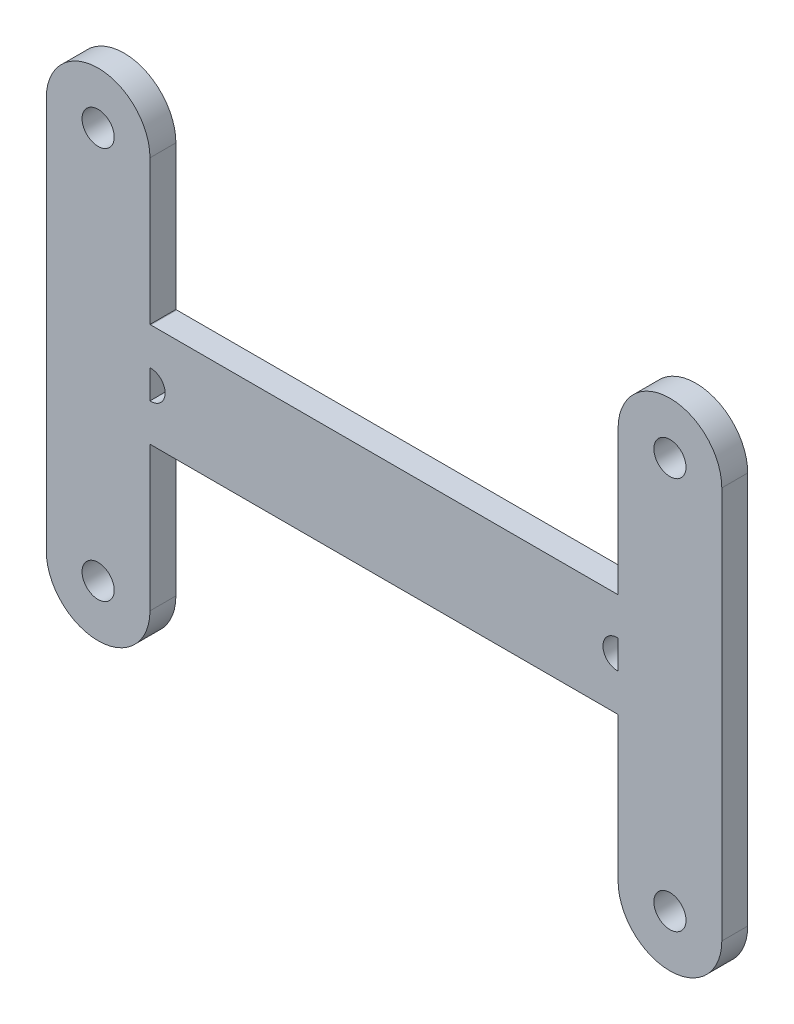
from build123d import *

# Parameters (mm, degrees)
SKETCH_2_R      = 1.55
SKETCH_2_R_2    = 1.384923923
EXTRUDE_1_DEPTH = 2.5


with BuildPart() as part:
    # 草图2 → 凸台-拉伸1 (new body)
    # profile 1 of 3: a face of its own
    with BuildSketch(Plane.XY):
        with BuildLine():
            Line((-22.577164466, 18.92268553), (-22.577164466, -18.92268553))
            ThreePointArc((-22.577164466, -18.92268553), (-27.577164466, -23.92268553), (-32.577164466, -18.92268553))
            Line((-32.577164466, -18.92268553), (-32.577164466, 18.92268553))
            ThreePointArc((-32.577164466, 18.92268553), (-27.577164466, 23.92268553), (-22.577164466, 18.92268553))
        make_face()
        with Locations((-27.577164466, -18.92268553)):
            Circle(SKETCH_2_R, mode=Mode.SUBTRACT)
        with Locations((-27.577164466, 18.92268553)):
            Circle(SKETCH_2_R, mode=Mode.SUBTRACT)
    # profile 2 of 3: a face of its own
    with BuildSketch(Plane.XY):
        with BuildLine():
            Line((22.577164466, 18.92268553), (22.577164466, -18.92268553))
            ThreePointArc((22.577164466, -18.92268553), (27.577164466, -23.92268553), (32.577164466, -18.92268553))
            Line((32.577164466, -18.92268553), (32.577164466, 18.92268553))
            ThreePointArc((32.577164466, 18.92268553), (27.577164466, 23.92268553), (22.577164466, 18.92268553))
        make_face()
        with Locations((27.577164466, -18.92268553)):
            Circle(SKETCH_2_R, mode=Mode.SUBTRACT)
        with Locations((27.577164466, 18.92268553)):
            Circle(SKETCH_2_R, mode=Mode.SUBTRACT)
    # profile 3 of 3: a face of its own
    with BuildSketch(Plane.XY):
        with BuildLine():
            Line((-22.5, 5), (22.5, 5))
            ThreePointArc((22.5, 5), (27.5, 0), (22.5, -5))
            Line((22.5, -5), (-22.5, -5))
            ThreePointArc((-22.5, -5), (-27.5, 0), (-22.5, 5))
        make_face()
        with Locations((-22.5, 0)):
            Circle(SKETCH_2_R_2, mode=Mode.SUBTRACT)
        with Locations((22.5, 0)):
            Circle(SKETCH_2_R_2, mode=Mode.SUBTRACT)
    extrude(amount=EXTRUDE_1_DEPTH)


solid = part.part
